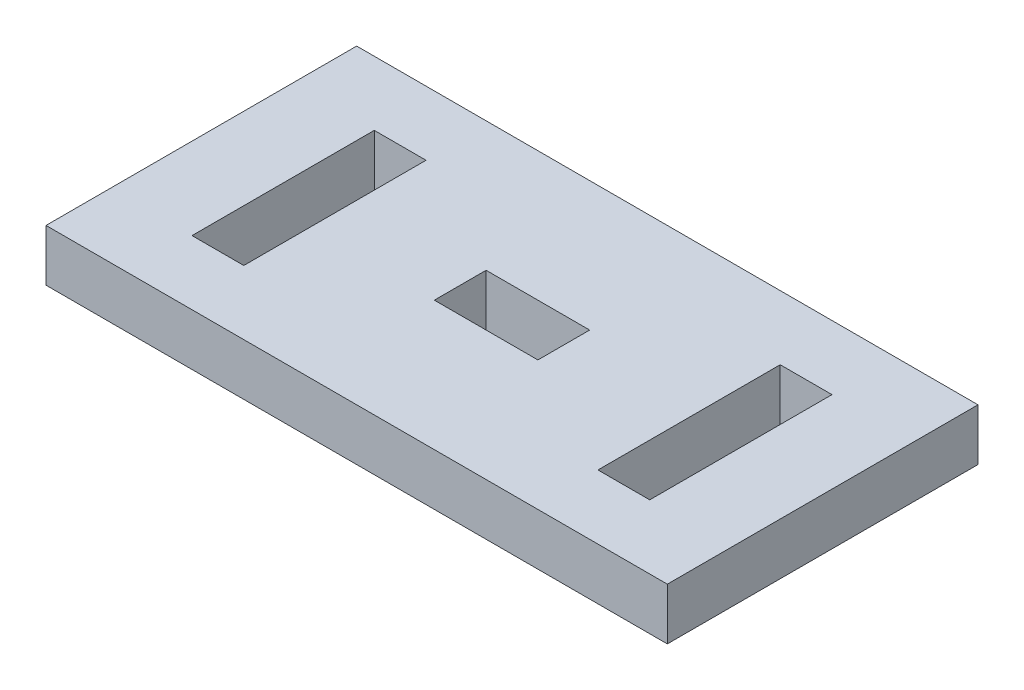
from build123d import *

# Parameters (mm, degrees)
SKETCH1_W           = 76.2
SKETCH1_H           = 38.1
SKETCH1_W_2         = 6.35
SKETCH1_H_2         = 22.352
SKETCH1_W_3         = 12.7
SKETCH1_H_3         = 6.35
BOSS_EXTRUDE1_DEPTH = 6.35


with BuildPart() as part:
    # Sketch1 → Boss-Extrude1 (new body)
    with BuildSketch(Plane(origin=(0, 0, 0), x_dir=(1, 0, 0), z_dir=(0, 1, 0))):
        with Locations((38.1, 19.05)):
            Rectangle(SKETCH1_W, SKETCH1_H)
        with Locations((13.208, 19.05)):
            Rectangle(SKETCH1_W_2, SKETCH1_H_2, mode=Mode.SUBTRACT)
        with Locations((62.992, 19.05)):
            Rectangle(SKETCH1_W_2, SKETCH1_H_2, mode=Mode.SUBTRACT)
        with Locations((38.1, 19.05)):
            Rectangle(SKETCH1_W_3, SKETCH1_H_3, mode=Mode.SUBTRACT)
    extrude(amount=BOSS_EXTRUDE1_DEPTH)


solid = part.part
